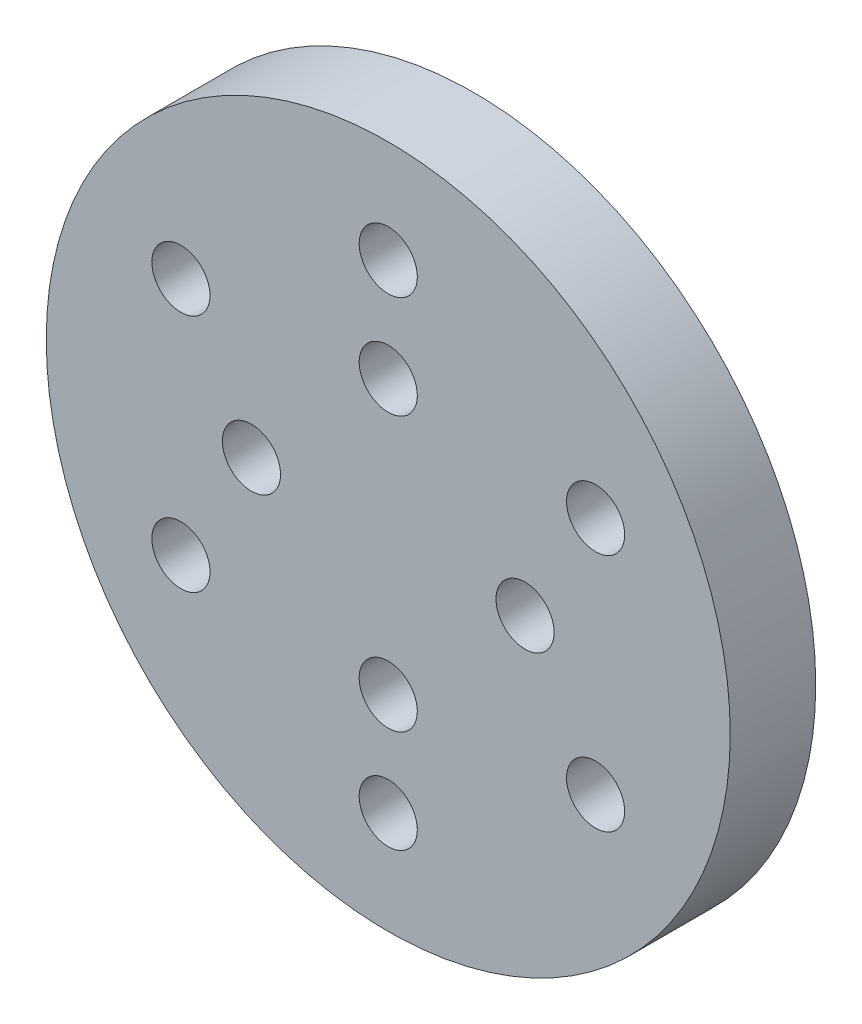
from build123d import *

# Parameters (mm, degrees)
SKETCH_1_R          = 20
SKETCH_1_R_2        = 1.7
EXTRUDE_1_DEPTH     = 5
SKETCH_2_R          = 1.7
CUT_EXTRUDE_1_DEPTH = 5


with BuildPart() as part:
    # 草图1 → 凸台-拉伸1 (new body)
    with BuildSketch(Plane.XY):
        Circle(SKETCH_1_R)
        with Locations((0, 8)):
            Circle(SKETCH_1_R_2, mode=Mode.SUBTRACT)
        with Locations((8, 0)):
            Circle(SKETCH_1_R_2, mode=Mode.SUBTRACT)
        with Locations((0, -8)):
            Circle(SKETCH_1_R_2, mode=Mode.SUBTRACT)
        with Locations((-8, 0)):
            Circle(SKETCH_1_R_2, mode=Mode.SUBTRACT)
    extrude(amount=EXTRUDE_1_DEPTH)

    # 草图2 → 切除-拉伸1 (cut)
    with BuildSketch(Plane.XY.offset(5)):
        with Locations((0, 14)):
            Circle(SKETCH_2_R)
        with Locations((12.124355653, 7)):
            Circle(SKETCH_2_R)
        with Locations((12.124355653, -7)):
            Circle(SKETCH_2_R)
        with Locations((0, -14)):
            Circle(SKETCH_2_R)
        with Locations((-12.124355653, -7)):
            Circle(SKETCH_2_R)
        with Locations((-12.124355653, 7)):
            Circle(SKETCH_2_R)
    extrude(amount=-CUT_EXTRUDE_1_DEPTH, mode=Mode.SUBTRACT)


solid = part.part
